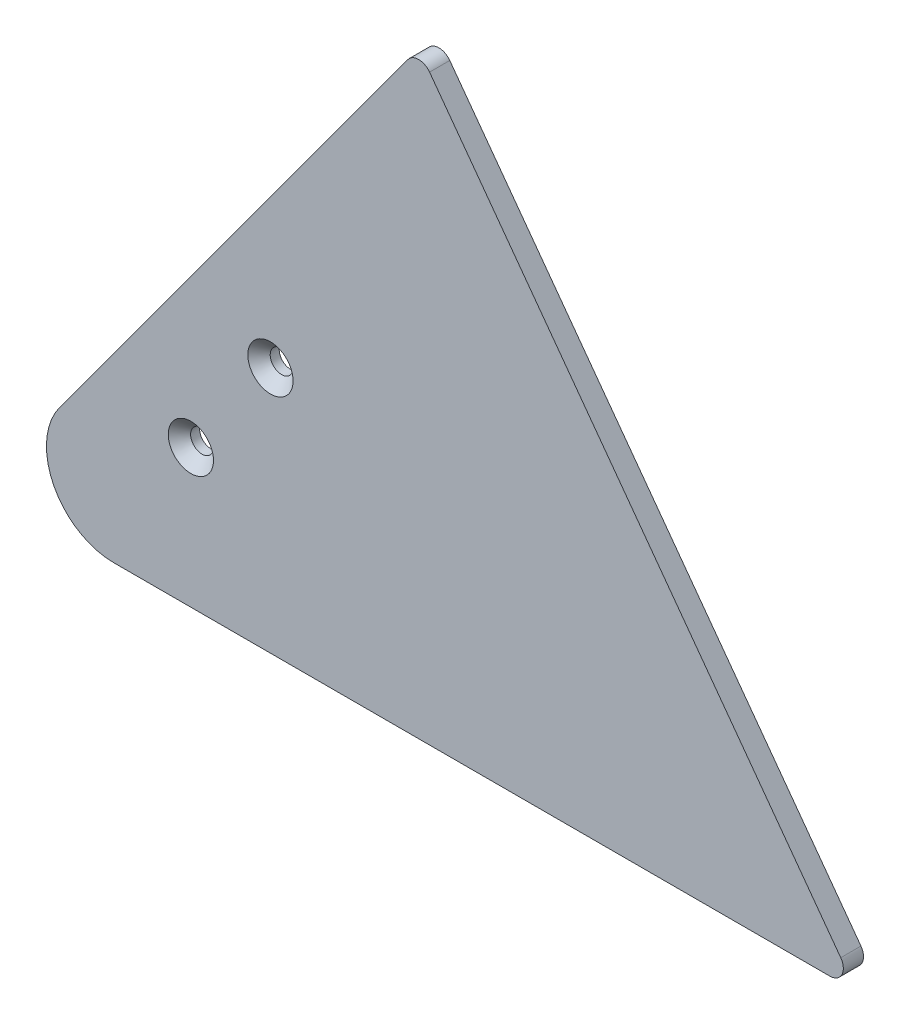
from build123d import *

# Parameters (mm, degrees)
EXTRUDE_1_DEPTH             = 3
SKETCH_2_R                  = 1.5
CUT_EXTRUDE_1_DEPTH         = 158.429349233
FILLET_1_R                  = 10
FILLET_2_R                  = 2
HOLE_WIZARD_M3_1_AT_2_COUNT = 2
HOLE_WIZARD_M3_1_AT_2_PITCH = 20


with BuildPart() as part:
    # 草图1 → 凸台-拉伸1 (new body)
    with BuildSketch(Plane.XY):
        Polygon((0, 0), (130, 0), (65, 88.741196746), align=None)
    extrude(amount=EXTRUDE_1_DEPTH)

    # 草图2 → 切除-拉伸1 (cut, through all)
    with BuildSketch(Plane.XY.offset(3)):
        with Locations((42.987595979, 36.688780191)):
            Circle(SKETCH_2_R)
        with Locations(Location((31.169414161, 20.554017147, 0), (0, 0, 180))):
            Circle(SKETCH_2_R)
    extrude(amount=-CUT_EXTRUDE_1_DEPTH, mode=Mode.SUBTRACT)

    # 圆角1
    fillet_1_edges = [part.edges().sort_by_distance(p)[0] for p in [
        (0, 0, 1.5),
    ]]
    fillet(fillet_1_edges, radius=FILLET_1_R)

    # 圆角2
    fillet_2_edges = [part.edges().sort_by_distance(p)[0] for p in [
        (65, 88.741196746, 1.5),
        (130, 0, 1.5),
    ]]
    fillet(fillet_2_edges, radius=FILLET_2_R)

    # 草图6 → M3 六角凹锥坑螺钉的锥形沉头孔1 (revolve, cut)
    with BuildSketch(Plane(origin=(42.987595979, 36.688780191, 3), x_dir=(0, -1, 0), z_dir=(1, 0, 0))):
        Polygon((0, 0), (0, 3), (1.7, 3), (1.7, 1.66), (3.36, 0), align=None)
    hole_wizard_m3_1 = revolve(axis=Axis((42.987595979, 36.688780191, 9.35), (0, 0, -1)), mode=Mode.SUBTRACT)

    # M3 六角凹锥坑螺钉的锥形沉头孔1 at 2: M3 六角凹锥坑螺钉的锥形沉头孔1 ×2
    with Locations(*[Vector(-0.5909090909090912, -0.8067381522408567, 0) * (i * HOLE_WIZARD_M3_1_AT_2_PITCH) for i in range(1, HOLE_WIZARD_M3_1_AT_2_COUNT)]):
        add(hole_wizard_m3_1, mode=Mode.SUBTRACT)


solid = part.part
